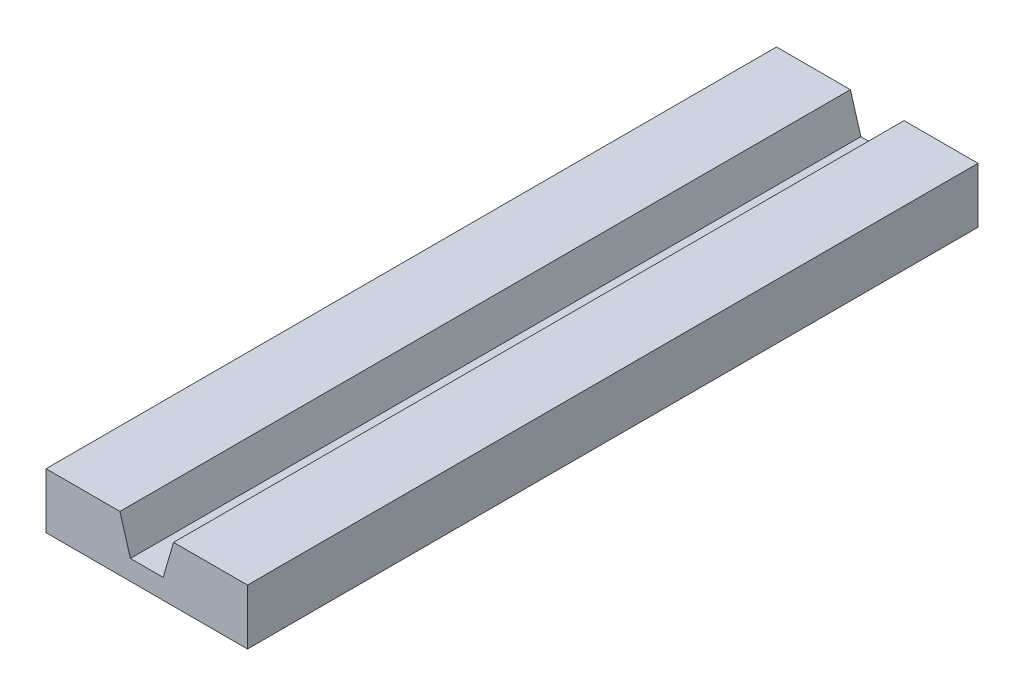
from build123d import *

# Parameters (mm, degrees)
SALIENTE_EXTRUIR1_DEPTH = 290


with BuildPart() as part:
    # Croquis1 → Saliente-Extruir1 (new body)
    with BuildSketch(Plane.XY):
        Polygon((-6.5, 0), (6.5, 0), (10.65, 14.1), (40, 14.1), (40, -7.9), (-40, -7.9), (-40, 14.1), (-10.65, 14.1), align=None)
    extrude(amount=-SALIENTE_EXTRUIR1_DEPTH)


solid = part.part
